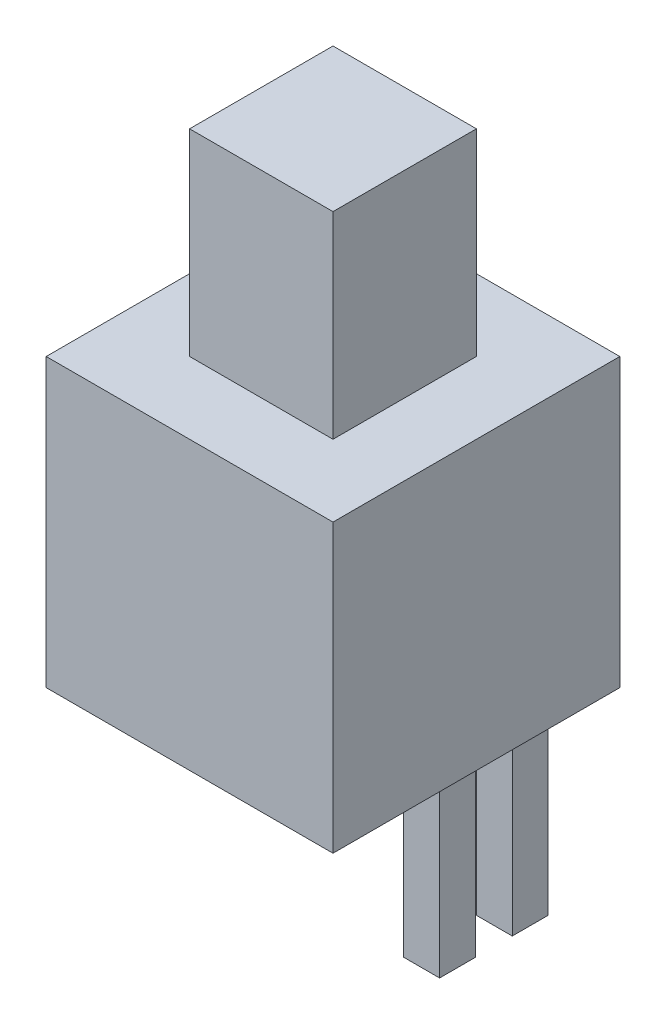
from build123d import *

# Parameters (mm, degrees)
SKETCH1_W           = 8
SKETCH1_H           = 8
BOSS_EXTRUDE1_DEPTH = 8
SKETCH2_W           = 4
SKETCH2_H           = 4
BOSS_EXTRUDE2_DEPTH = 5.5
SKETCH3_W           = 1
SKETCH3_H           = 1
BOSS_EXTRUDE3_DEPTH = 5.5


with BuildPart() as part:
    # Sketch1 → Boss-Extrude1 (new body)
    with BuildSketch(Plane(origin=(0, 0, 0), x_dir=(1, 0, 0), z_dir=(0, 1, 0))):
        Rectangle(SKETCH1_W, SKETCH1_H)
    extrude(amount=BOSS_EXTRUDE1_DEPTH)

    # Sketch2 → Boss-Extrude2 (add)
    with BuildSketch(Plane(origin=(0, 8, 0), x_dir=(1, 0, 0), z_dir=(0, 1, 0))):
        Rectangle(SKETCH2_W, SKETCH2_H)
    extrude(amount=BOSS_EXTRUDE2_DEPTH)

    # Sketch3 → Boss-Extrude3 (add)
    with BuildSketch(Plane.XZ):
        with Locations((2.5, -2.5)):
            Rectangle(SKETCH3_W, SKETCH3_H)
        with Locations((2.5, -0.47334968)):
            Rectangle(SKETCH3_W, SKETCH3_H)
    extrude(amount=BOSS_EXTRUDE3_DEPTH)


solid = part.part
